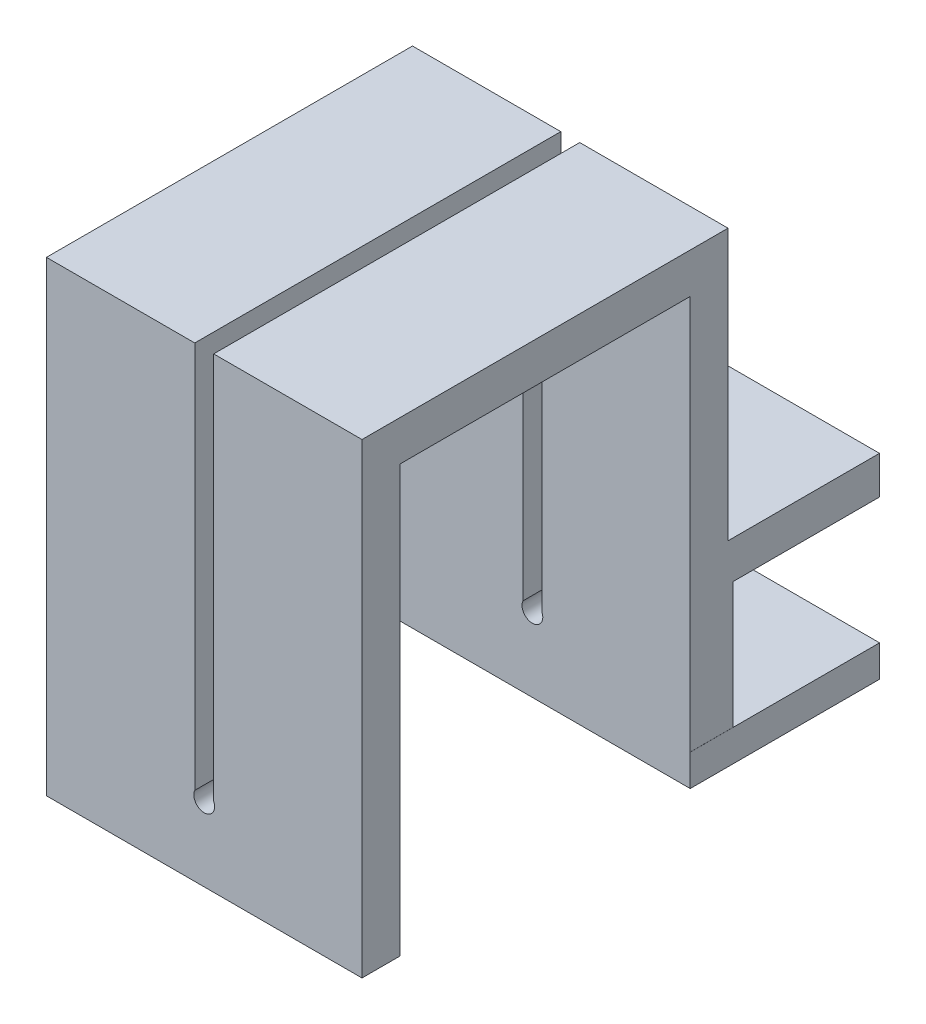
from build123d import *

# Parameters (mm, degrees)
EXTRUDE_1_DEPTH     = 6
SKETCH_2_W          = 50.01074492
SKETCH_2_H          = 5
EXTRUDE_2_DEPTH     = 30
SKETCH_4_R          = 1.75
CUT_EXTRUDE_1_DEPTH = 30
EXTRUDE_START       = 1.5
SKETCH_6_W          = 10
SKETCH_6_H          = 6
SKETCH_6_R          = 1.75
EXTRUDE_4_DEPTH     = 1.5
EXTRUDE_6_DEPTH     = 50
CUT_EXTRUDE_2_REACH = 105.013
SKETCH_15_W         = 1.024057277
SKETCH_15_H         = 0.768849672
EXTRUDE_10_DEPTH    = 20
EXTRUDE_11_DEPTH    = 6
SKETCH_17_W         = 10
SKETCH_17_H         = 6
SKETCH_17_R         = 1.75
EXTRUDE_12_DEPTH    = 1.5
CUT_EXTRUDE_START   = -100
SKETCH_18_R         = 1.75
CUT_EXTRUDE_3_DEPTH = 100


with BuildPart() as part:
    # Эскиз1 → Бобышка-Вытянуть1 (new body)
    with BuildSketch(Plane.XY):
        Polygon((0, 0), (8.5, 0), (11.5, 0), (38.5, 0), (41.5, 0), (50, 0), (50, 10), (50, 30), (30, 30), (20, 30), (0, 30), (0, 10), align=None)
        with BuildLine():
            Line((28, 22.5), (28, 7.5))
            ThreePointArc((28, 7.5), (25, 4.5), (22, 7.5))
            Line((22, 7.5), (22, 22.5))
            ThreePointArc((22, 22.5), (25, 25.5), (28, 22.5))
        make_face(mode=Mode.SUBTRACT)
    extrude(amount=EXTRUDE_1_DEPTH)

    # Эскиз2 → Бобышка-Вытянуть2 (add)
    with BuildSketch(Plane.XY.offset(6)):
        with Locations((25.00537246, -2.5)):
            Rectangle(SKETCH_2_W, SKETCH_2_H)
    extrude(amount=-EXTRUDE_2_DEPTH)

    # Эскиз4 → Вырез-Вытянуть1 (cut)
    with BuildSketch(Plane(origin=(0, 0, 0), x_dir=(1, 0, 0), z_dir=(0, 1, 0))):
        with Locations(Location((25, 14, 0), (0, 0, 270))):
            Circle(SKETCH_4_R)
    extrude(amount=-CUT_EXTRUDE_1_DEPTH, mode=Mode.SUBTRACT)

    # Эскиз6 → Бобышка-Вытянуть4 (add)
    with BuildSketch(Plane(origin=(0, 0, 0), x_dir=(1, 0, 0), z_dir=(0, 1, 0)).offset(EXTRUDE_START)):
        with Locations((25, 14)):
            Rectangle(SKETCH_6_W, SKETCH_6_H)
        with Locations(Location((25, 14, 0), (0, 0, 270))):
            Circle(SKETCH_6_R, mode=Mode.SUBTRACT)
    extrude(amount=-EXTRUDE_4_DEPTH)

    # Эскиз7 → Бобышка-Вытянуть6 (add)
    with BuildSketch(Plane.ZY):
        Polygon((58, -5), (58, 68.895321777), (0, 68.895321777), (0, 62.524087888), (0, -5), (6, -5), (6, 62.524087888), (52, 62.524087888), (52, -5), align=None)
    extrude(amount=-EXTRUDE_6_DEPTH)

    # Вырез-Вытянуть2: up to this face of the body (flat: up to its plane)
    cut_extrude_2_end = Plane(part.part.faces().sort_by_distance((25, 31.947660889, 58))[0])
    # Эскиз8 → Вырез-Вытянуть2 (cut, up to the picked face)
    with BuildSketch(Plane(origin=(0, 0, 0), x_dir=(-1, 0, 0), z_dir=(0, 0, -1)), mode=Mode.PRIVATE) as cut_extrude_2_sk1:
        with BuildLine():
            Line((-26.5, 112.5), (-23.5, 112.5))
            Line((-23.5, 112.5), (-23.5, 7.5))
            ThreePointArc((-23.5, 7.5), (-25, 5.175598625), (-26.5, 7.5))
            Line((-26.5, 7.5), (-26.5, 112.5))
        make_face()
    cut_extrude_2_tool1 = split(extrude(cut_extrude_2_sk1.sketch, amount=-CUT_EXTRUDE_2_REACH, mode=Mode.PRIVATE), bisect_by=cut_extrude_2_end, keep=Keep.BOTH, mode=Mode.PRIVATE)
    add(cut_extrude_2_tool1.solids().sort_by(Axis((25, 58.930041, 0), (0, 0, 1)))[0], mode=Mode.SUBTRACT)

    # Эскиз15 → Бобышка-Вытянуть10 (add)
    with BuildSketch(Plane(origin=(0, 0, 0), x_dir=(1, 0, 0), z_dir=(0, 1, 0))):
        with Locations((49.487971362, 0.384424836)):
            Rectangle(SKETCH_15_W, SKETCH_15_H)
    extrude(amount=EXTRUDE_10_DEPTH)

    # Эскиз16 → Бобышка-Вытянуть11 (add)
    with BuildSketch(Plane(origin=(0, 20, 0), x_dir=(1, 0, 0), z_dir=(0, 1, 0))):
        Polygon((50, 0), (28.5, 0), (28.5, 4), (21.5, 4), (21.5, 0), (0, 0), (0, 24), (50, 24), align=None)
    extrude(amount=EXTRUDE_11_DEPTH)

    # Эскиз17 → Бобышка-Вытянуть12 (add)
    with BuildSketch(Plane.XZ.offset(-20)):
        with Locations((25, -14)):
            Rectangle(SKETCH_17_W, SKETCH_17_H)
        with Locations(Location((25, -14, 0), (0, 0, 90))):
            Circle(SKETCH_17_R, mode=Mode.SUBTRACT)
    extrude(amount=EXTRUDE_12_DEPTH)

    # Эскиз18 → Вырез-Вытянуть3 (cut)
    with BuildSketch(Plane.XZ.offset(-18.5).offset(CUT_EXTRUDE_START)):
        with Locations(Location((25, -14, 0), (0, 0, 90))):
            Circle(SKETCH_18_R)
    extrude(amount=CUT_EXTRUDE_3_DEPTH, mode=Mode.SUBTRACT)


solid = part.part
